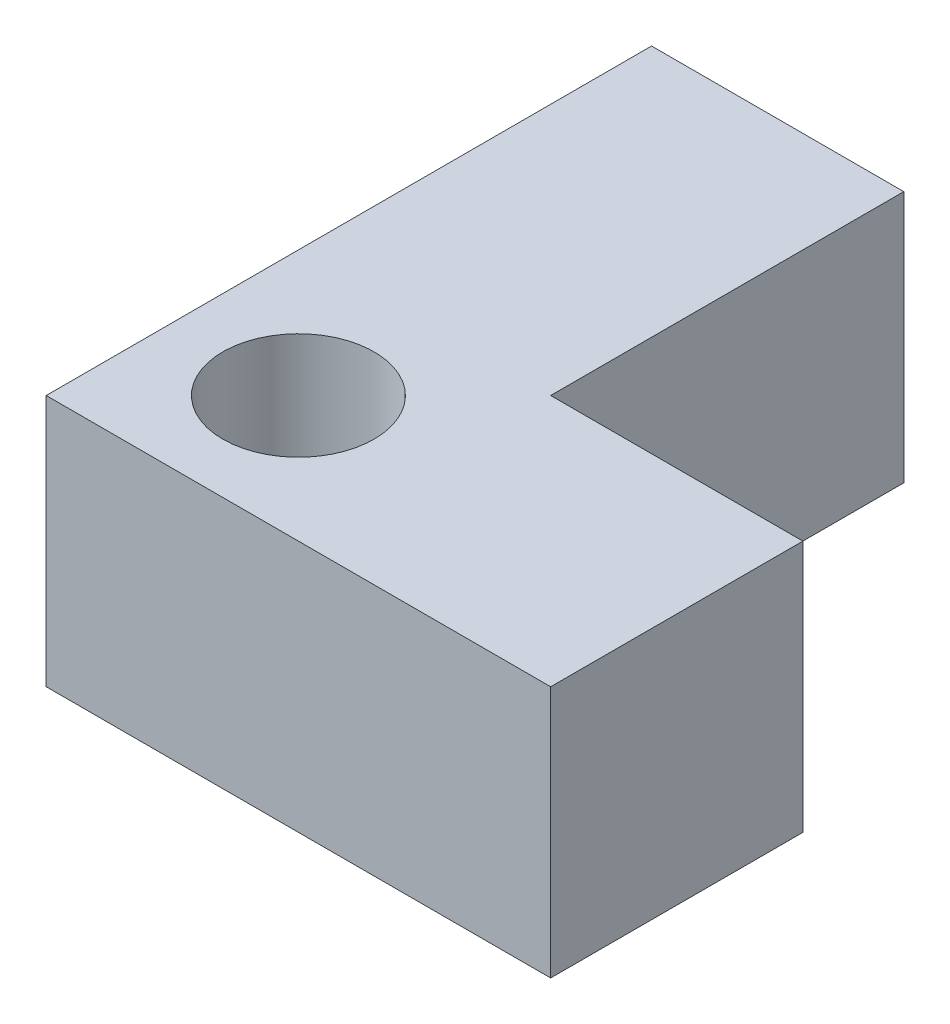
from build123d import *

# Parameters (mm, degrees)
BOSS_EXTRUDE1_DEPTH = 5
SKETCH4_R           = 1.5
CUT_EXTRUDE1_DEPTH  = 17.401219467


with BuildPart() as part:
    # Sketch3 → Boss-Extrude1 (new body)
    with BuildSketch(Plane(origin=(0, 0, 0), x_dir=(1, 0, 0), z_dir=(0, 1, 0))):
        Polygon((0, 0), (10, 0), (10, 5), (5, 5), (5, 12), (0, 12), align=None)
    extrude(amount=BOSS_EXTRUDE1_DEPTH)

    # Sketch4 → Cut-Extrude1 (cut, through all)
    with BuildSketch(Plane(origin=(0, 5, 0), x_dir=(1, 0, 0), z_dir=(0, 1, 0))):
        with Locations(Location((2.5, 2.5, 0), (0, 0, 270))):
            Circle(SKETCH4_R)
    extrude(amount=-CUT_EXTRUDE1_DEPTH, mode=Mode.SUBTRACT)


solid = part.part
